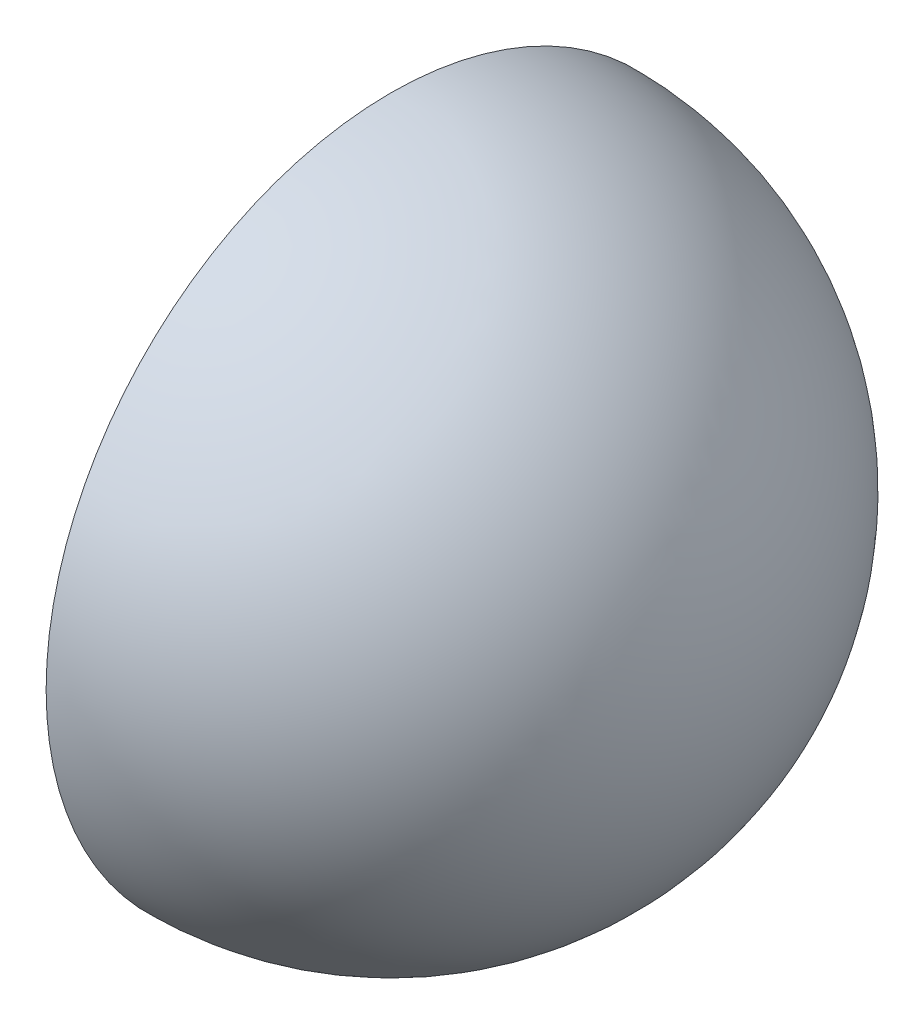
from build123d import *


with BuildPart() as part:
    # Sketch2 → Revolve-Thin4 (revolve)
    with BuildSketch(Plane(origin=(0, 0, 0), x_dir=(1, 0, 0), z_dir=(0, 1, 0))):
        with BuildLine():
            ThreePointArc((0, 17), (12.02081528, 12.02081528), (17, 0))
            Line((17, 0), (15, 0))
            ThreePointArc((15, 0), (10.606601718, 10.606601718), (0, 15))
            Line((0, 15), (0, 17))
        make_face()
    revolve(axis=Axis((13, 0, 0), (1, 0, 0)))


solid = part.part
